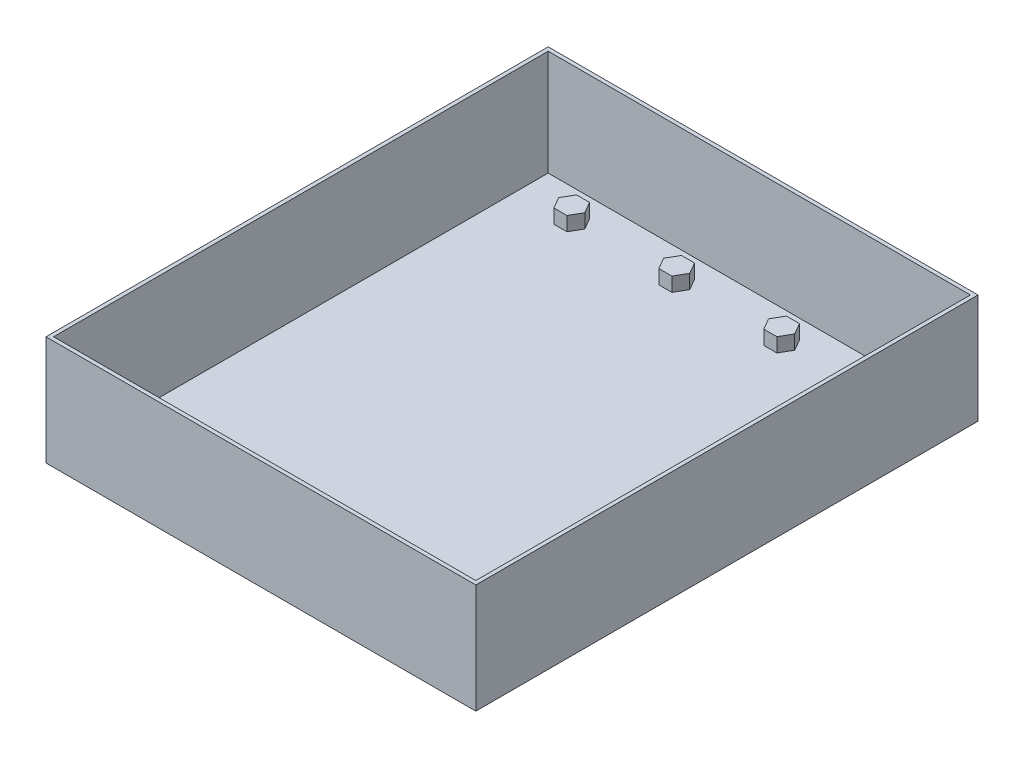
from build123d import *

# Parameters (mm, degrees)
SKETCH1_W           = 180.975
SKETCH1_H           = 211.455
BOSS_EXTRUDE1_DEPTH = 46.0375
SHELL1_T            = -1.5875
BOSS_EXTRUDE2_DEPTH = 5.953125


with BuildPart() as part:
    # Sketch1 → Boss-Extrude1 (new body)
    with BuildSketch(Plane(origin=(0, 0, 0), x_dir=(1, 0, 0), z_dir=(0, 1, 0))):
        Rectangle(SKETCH1_W, SKETCH1_H)
    extrude(amount=BOSS_EXTRUDE1_DEPTH)

    # Shell1
    shell1_openings = [part.faces().sort_by_distance(p)[0] for p in [
        (0, 46.0375, 0),
    ]]
    offset(amount=SHELL1_T, openings=shell1_openings, kind=Kind.INTERSECTION)

    # Sketch3 → Boss-Extrude2 (add)
    with BuildSketch(Plane(origin=(0, 1.5875, 0), x_dir=(1, 0, 0), z_dir=(0, 1, 0))):
        Polygon((-27.597261314, -91.44), (-24.847630657, -96.2025), (-19.348369343, -96.2025), (-16.598738686, -91.44), (-19.348369343, -86.6775), (-24.847630657, -86.6775), align=None)
        Polygon((-71.793261314, -91.44), (-69.043630657, -96.2025), (-63.544369343, -96.2025), (-60.794738686, -91.44), (-63.544369343, -86.6775), (-69.043630657, -86.6775), align=None)
        Polygon((16.598738686, -91.44), (19.348369343, -96.2025), (24.847630657, -96.2025), (27.597261314, -91.44), (24.847630657, -86.6775), (19.348369343, -86.6775), align=None)
        Polygon((60.794738686, -91.44), (63.544369343, -96.2025), (69.043630657, -96.2025), (71.793261314, -91.44), (69.043630657, -86.6775), (63.544369343, -86.6775), align=None)
        Polygon((-27.597261314, 91.44), (-24.847630657, 86.6775), (-19.348369343, 86.6775), (-16.598738686, 91.44), (-19.348369343, 96.2025), (-24.847630657, 96.2025), align=None)
        Polygon((16.598738686, 91.44), (19.348369343, 86.6775), (24.847630657, 86.6775), (27.597261314, 91.44), (24.847630657, 96.2025), (19.348369343, 96.2025), align=None)
        Polygon((60.794738686, 91.44), (63.544369343, 86.6775), (69.043630657, 86.6775), (71.793261314, 91.44), (69.043630657, 96.2025), (63.544369343, 96.2025), align=None)
        Polygon((-71.793261314, 91.44), (-69.043630657, 86.6775), (-63.544369343, 86.6775), (-60.794738686, 91.44), (-63.544369343, 96.2025), (-69.043630657, 96.2025), align=None)
    extrude(amount=BOSS_EXTRUDE2_DEPTH)


solid = part.part
